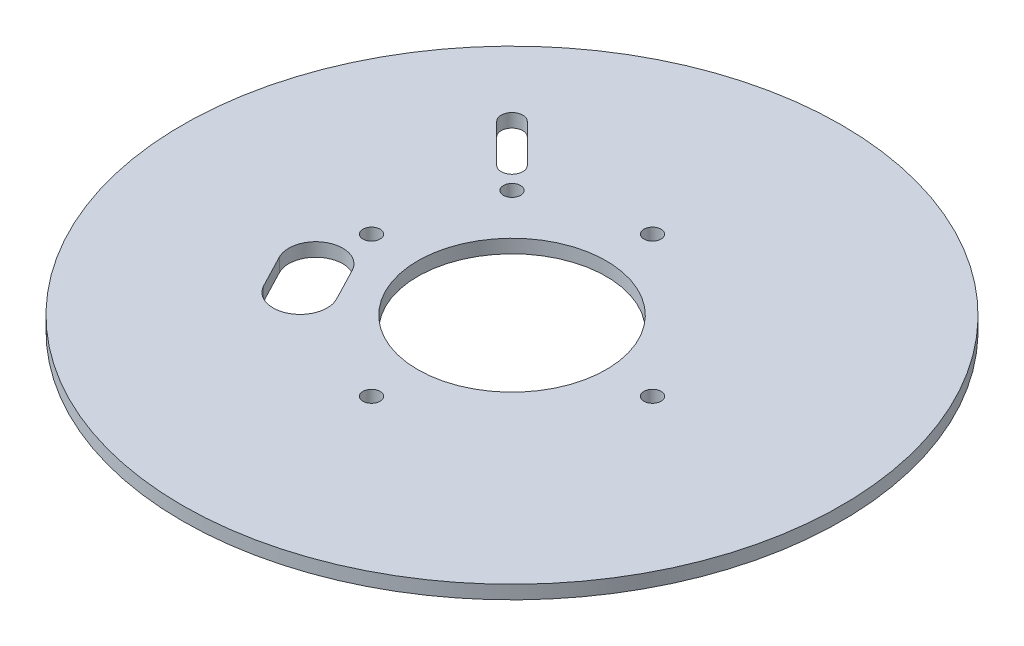
from build123d import *

# Parameters (mm, degrees)
SKETCH1_R           = 77.4600051
BOSS_EXTRUDE1_DEPTH = 3.175
SKETCH24_R          = 22.1615
SKETCH24_R_2        = 2.0193
CUT_EXTRUDE14_DEPTH = 110.590991442


with BuildPart() as part:
    # Sketch1 → Boss-Extrude1 (new body)
    with BuildSketch(Plane(origin=(0, 0, 0), x_dir=(1, 0, 0), z_dir=(0, 1, 0))):
        with Locations(Location((0, 0, 0), (0, 0, 270))):
            Circle(SKETCH1_R)
    extrude(amount=BOSS_EXTRUDE1_DEPTH)

    # Sketch24 → Cut-Extrude14 (cut, through all)
    with BuildSketch(Plane(origin=(0, 3.175, 0), x_dir=(1, 0, 0), z_dir=(0, 1, 0))):
        with Locations(Location((0, 0, 0), (0, 0, 270))):
            Circle(SKETCH24_R)
        with Locations(Location((-25.4, 25.4, 0), (0, 0, 270))):
            Circle(SKETCH24_R_2)
        with Locations(Location((0, 33.02, 0), (0, 0, 270))):
            Circle(SKETCH24_R_2)
        with Locations(Location((33.02, 0, 0), (0, 0, 270))):
            Circle(SKETCH24_R_2)
        with Locations(Location((0, -33.02, 0), (0, 0, 270))):
            Circle(SKETCH24_R_2)
        with Locations(Location((-33.02, 0, 0), (0, 0, 270))):
            Circle(SKETCH24_R_2)
        with BuildLine():
            Line((-32.276051224, 28.683948776), (-41.256307345, 37.664204897))
            ThreePointArc((-41.256307345, 37.664204897), (-41.256307345, 41.256307345), (-37.664204897, 41.256307345))
            Line((-37.664204897, 41.256307345), (-28.683948776, 32.276051224))
            ThreePointArc((-28.683948776, 32.276051224), (-28.683948776, 28.683948776), (-32.276051224, 28.683948776))
        make_face()
        with BuildLine():
            Line((-27.903416949, -9.657564215), (-23.915755925, -17.31778977))
            ThreePointArc((-23.915755925, -17.31778977), (-26.616171022, -25.882412255), (-35.180793507, -23.181997158))
            Line((-35.180793507, -23.181997158), (-39.16845453, -15.521771603))
            ThreePointArc((-39.16845453, -15.521771603), (-36.468039434, -6.957149118), (-27.903416949, -9.657564215))
        make_face()
    extrude(amount=-CUT_EXTRUDE14_DEPTH, mode=Mode.SUBTRACT)


solid = part.part
